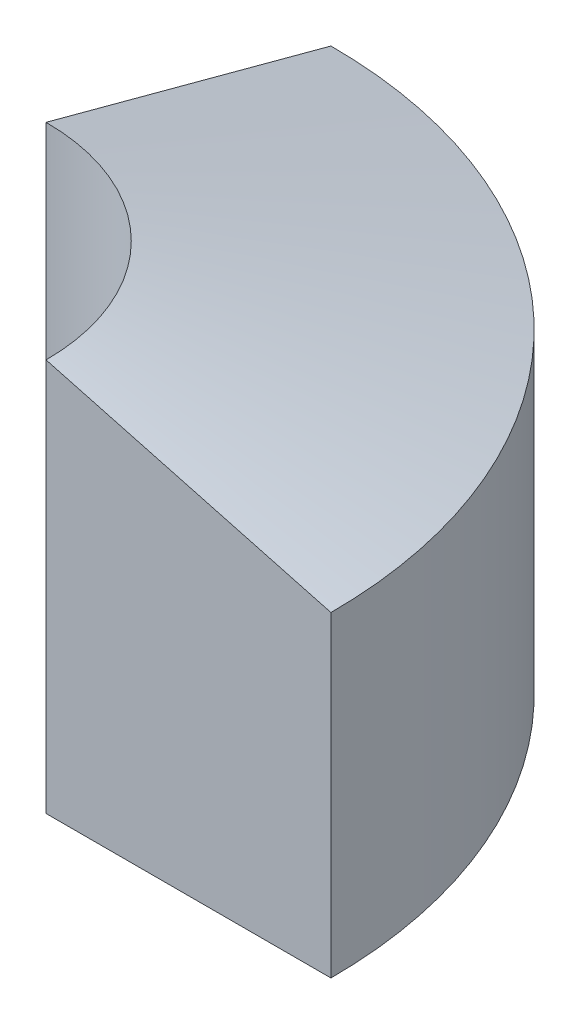
from build123d import *

# Parameters (mm, degrees)
AUFSATZ_LINEAR_AUSTRAGEN1_DEPTH = 12.5
M8_GEWINDEBOHRUNG1_D            = 6.8
M8_GEWINDEBOHRUNG1_DEPTH        = 16.25
M8_GEWINDEBOHRUNG1_TIP          = 2.042926105


with BuildPart() as part:
    # Skizze1 → Aufsatz-Linear austragen1 (new, symmetric)
    with BuildSketch(Plane(origin=(0, 0, 0), x_dir=(1, 0, 0), z_dir=(0, 1, 0))):
        with BuildLine():
            Line((0, 31), (0, 13))
            ThreePointArc((0, 13), (9.192388155, 9.192388155), (13, 0))
            Line((13, 0), (31, 0))
            ThreePointArc((31, 0), (21.920310217, 21.920310217), (0, 31))
        make_face()
    extrude(amount=AUFSATZ_LINEAR_AUSTRAGEN1_DEPTH, both=True)

    # Schnitt-Austragung1: sweep along a curve in space
    with BuildLine() as schnitt_austragung1_path:
        ThreePointArc((31, 12.5, 0), (21.920310217, 12.5, -21.920310217), (0, 12.5, -31))
    # Skizze2 → Schnitt-Austragung1 (sweep, cut)
    with BuildSketch(Plane.XY):
        Polygon((13, 12.5), (31, 12.5), (31, 7.5), (13, 12.323085464), align=None)
    sweep(path=schnitt_austragung1_path.line, mode=Mode.SUBTRACT)

    # M8 Gewindebohrung1
    with Locations(Plane(origin=(0, -12.5, 0), x_dir=(-1, 0, 0), z_dir=(0, -1, 0))):
        with Locations((-6.798373876, 20.923243358), (-20.923243358, 6.798373876)):
            Hole(M8_GEWINDEBOHRUNG1_D / 2, depth=M8_GEWINDEBOHRUNG1_DEPTH)
            with Locations((0, 0, -(M8_GEWINDEBOHRUNG1_DEPTH + M8_GEWINDEBOHRUNG1_TIP / 2))):  # 118° drill point
                Cone(0, M8_GEWINDEBOHRUNG1_D / 2, M8_GEWINDEBOHRUNG1_TIP, mode=Mode.SUBTRACT)


solid = part.part
